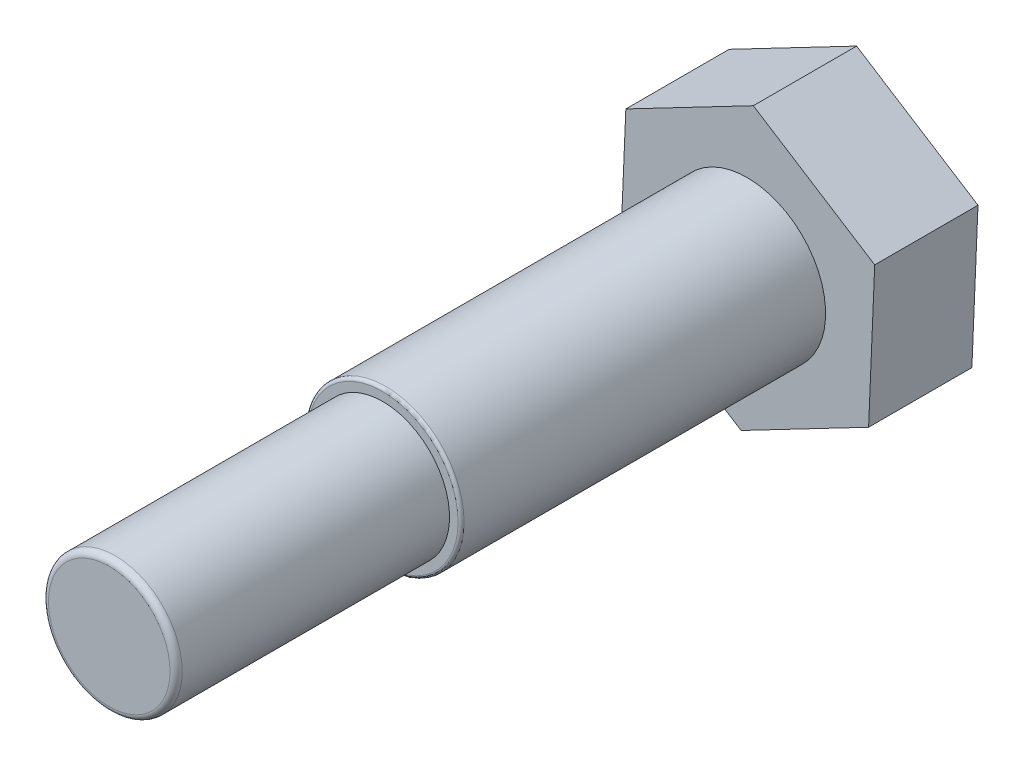
from build123d import *

# Parameters (mm, degrees)
EXTRUDE_307_DEPTH = 17
SKETCH_2_R        = 12.9
EXTRUDE_1_DEPTH   = 60
SKETCH_3_R        = 11
EXTRUDE_2_DEPTH   = 45
FILLET_2_R        = 1
FILLET_4_R        = 0.5


with BuildPart() as part:
    # 草图1 → Extrude 307 (new body)
    with BuildSketch(Plane.XY):
        Polygon((20.984201837, 10.954296262), (1.005402075, 23.65), (-19.978799762, 12.695703738), (-20.984201837, -10.954296262), (-1.005402075, -23.65), (19.978799762, -12.695703738), align=None)
    extrude(amount=EXTRUDE_307_DEPTH)

    # 草图2 → 凸台-拉伸1 (add)
    with BuildSketch(Plane.XY.offset(17)):
        with Locations(Location((0, 0, 0), (0, 0, 180))):
            Circle(SKETCH_2_R)
    extrude(amount=EXTRUDE_1_DEPTH)

    # 草图3 → 凸台-拉伸2 (add)
    with BuildSketch(Plane.XY.offset(77)):
        with Locations(Location((0, 0, 0), (0, 0, 180))):
            Circle(SKETCH_3_R)
    extrude(amount=EXTRUDE_2_DEPTH)

    # 圆角2
    fillet_2_edges = [part.edges().sort_by_distance(p)[0] for p in [
        (11, 0, 122),
    ]]
    fillet(fillet_2_edges, radius=FILLET_2_R)

    # 圆角4
    fillet_4_edges = [part.edges().sort_by_distance(p)[0] for p in [
        (12.9, 0, 77),
    ]]
    fillet(fillet_4_edges, radius=FILLET_4_R)


solid = part.part
